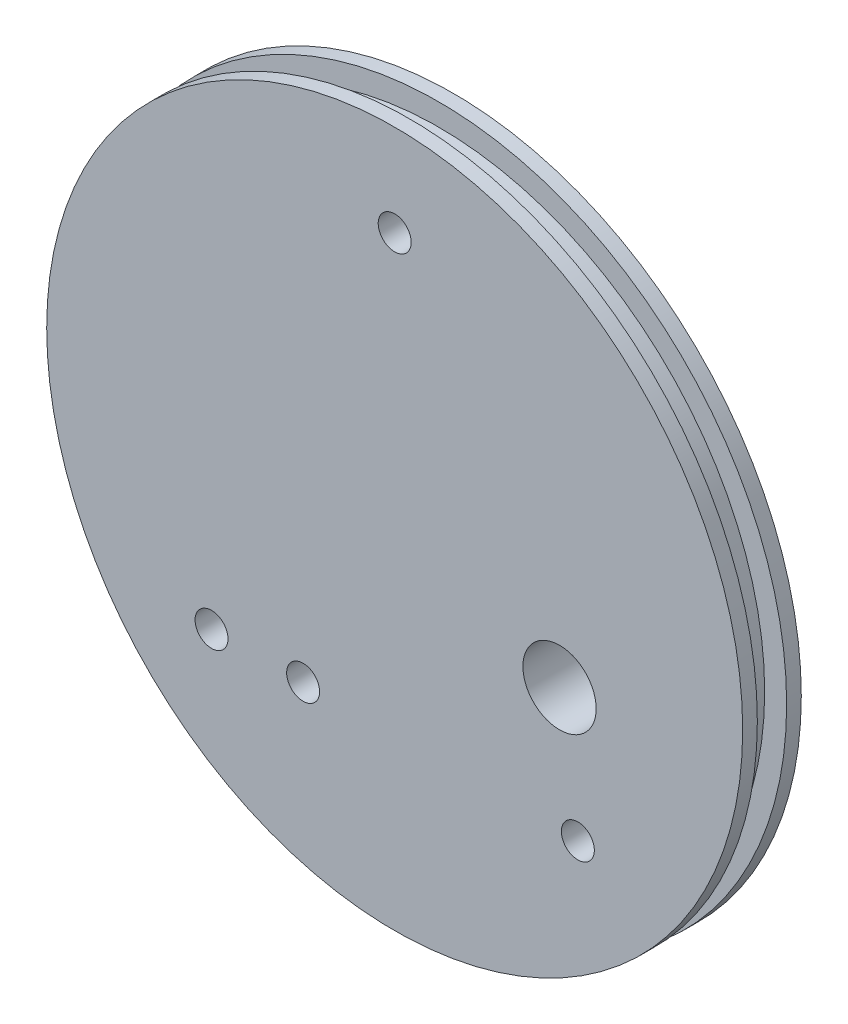
from build123d import *

# Parameters (mm, degrees)
BOSS_EXTRUDE1_DEPTH      = 8
BOSS_EXTRUDE1_DEPTH_BACK = 8
SKETCH2_R                = 95
CUT_EXTRUDE1_DEPTH       = 4
CUT_EXTRUDE1_DEPTH_BACK  = 4
SKETCH2_5_R              = 95
SKETCH2_5_R_2            = 89
SKETCH7_R                = 4.5
CUT_EXTRUDE2_DEPTH       = 167
CUT_EXTRUDE4_DEPTH       = 112
CUT_EXTRUDE4_DEPTH_BACK  = 60
SKETCH10_R               = 4.5
SKETCH11_R               = 10
CUT_EXTRUDE5_DEPTH       = 60


with BuildPart() as part:
    # Sketch2 → Boss-Extrude1 (new, two sides: drawn at the far end of the back side and taken through both)
    with BuildSketch(Plane.XY.offset(-BOSS_EXTRUDE1_DEPTH_BACK)):
        Circle(SKETCH2_R)
    extrude(amount=BOSS_EXTRUDE1_DEPTH + BOSS_EXTRUDE1_DEPTH_BACK)

    # Sketch2<5> → Cut-Extrude1 (cut, two sides: drawn at the far end of the back side and taken through both)
    with BuildSketch(Plane.XY.offset(-CUT_EXTRUDE1_DEPTH_BACK)):
        Circle(SKETCH2_5_R)
        Circle(SKETCH2_5_R_2, mode=Mode.SUBTRACT)
    extrude(amount=CUT_EXTRUDE1_DEPTH + CUT_EXTRUDE1_DEPTH_BACK, mode=Mode.SUBTRACT)

    # Sketch7 → Cut-Extrude2 (cut)
    with BuildSketch(Plane.XY.offset(8)):
        with Locations((-50, -48.75)):
            Circle(SKETCH7_R)
        with Locations((50, -48.75)):
            Circle(SKETCH7_R)
        with Locations((-25, -48.75)):
            Circle(SKETCH7_R)
    extrude(amount=-CUT_EXTRUDE2_DEPTH, mode=Mode.SUBTRACT)

    # Sketch10 → Cut-Extrude4 (cut, two sides: drawn at the far end of the back side and taken through both)
    with BuildSketch(Plane(origin=(0, 0, -8), x_dir=(-1, 0, 0), z_dir=(0, 0, -1)).offset(-CUT_EXTRUDE4_DEPTH_BACK)):
        with Locations((0, 70)):
            Circle(SKETCH10_R)
    extrude(amount=CUT_EXTRUDE4_DEPTH + CUT_EXTRUDE4_DEPTH_BACK, mode=Mode.SUBTRACT)

    # Sketch11 → Cut-Extrude5 (cut)
    with BuildSketch(Plane(origin=(0, 0, -8), x_dir=(-1, 0, 0), z_dir=(0, 0, -1))):
        with Locations((-45, -15)):
            Circle(SKETCH11_R)
    extrude(amount=-CUT_EXTRUDE5_DEPTH, mode=Mode.SUBTRACT)


solid = part.part
